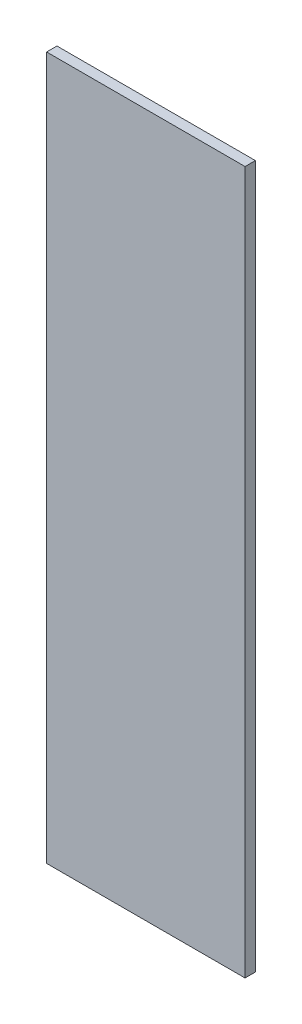
from build123d import *

# Parameters (mm, degrees)
SKETCH1_W           = 96
SKETCH1_H           = 340
BOSS_EXTRUDE1_DEPTH = 2.5


with BuildPart() as part:
    # Sketch1 → Boss-Extrude1 (new, symmetric)
    with BuildSketch(Plane.XY):
        Rectangle(SKETCH1_W, SKETCH1_H)
    extrude(amount=BOSS_EXTRUDE1_DEPTH, both=True)


solid = part.part
